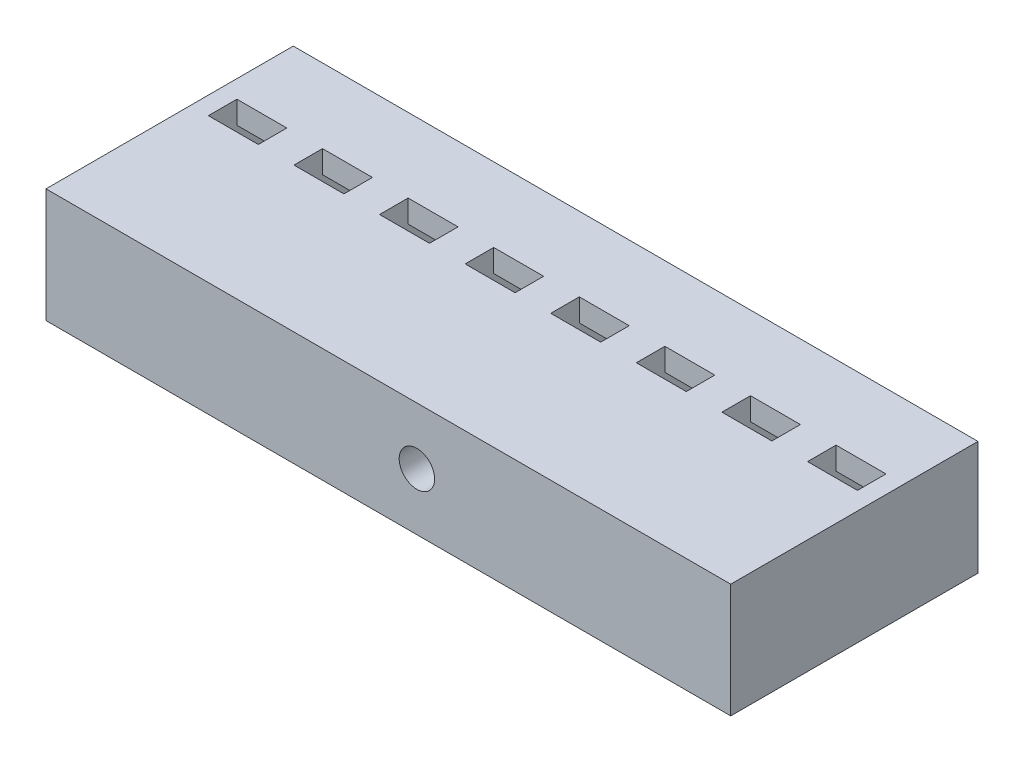
from build123d import *

# Parameters (mm, degrees)
SKETCH1_W           = 72
SKETCH1_H           = 22
BOSS_EXTRUDE1_DEPTH = 12
SKETCH2_W           = 5.25
SKETCH2_H           = 3
CUT_EXTRUDE1_DEPTH  = 77.23647421
LPATTERN2_COUNT     = 8
LPATTERN2_PITCH     = 9
SKETCH3_W           = 5.25
SKETCH3_H           = 7.25
CUT_EXTRUDE2_DEPTH  = 77.23647421
LPATTERN3_COUNT     = 8
LPATTERN3_PITCH     = 9
SKETCH4_W           = 72
SKETCH4_H           = 12
BOSS_EXTRUDE2_DEPTH = 4
SKETCH11_W          = 72
SKETCH11_H          = 12
BOSS_EXTRUDE3_DEPTH = 4
SKETCH12_R          = 1.865
CUT_EXTRUDE9_DEPTH  = 6


with BuildPart() as part:
    # Sketch1 → Boss-Extrude1 (new body)
    with BuildSketch(Plane(origin=(0, 0, 0), x_dir=(1, 0, 0), z_dir=(0, 1, 0))):
        with Locations((-36, 11)):
            Rectangle(SKETCH1_W, SKETCH1_H)
    extrude(amount=BOSS_EXTRUDE1_DEPTH)

    # Sketch2 → Cut-Extrude1 (cut, through all)
    with BuildSketch(Plane(origin=(0, 12, 0), x_dir=(1, 0, 0), z_dir=(0, 1, 0))):
        with Locations((-67.5, 12.7)):
            Rectangle(SKETCH2_W, SKETCH2_H)
    cut_extrude1 = extrude(amount=-CUT_EXTRUDE1_DEPTH, mode=Mode.SUBTRACT)

    # LPattern2: Cut-Extrude1 ×8
    with Locations(*[(i * LPATTERN2_PITCH, 0, 0) for i in range(1, LPATTERN2_COUNT)]):
        add(cut_extrude1, mode=Mode.SUBTRACT)

    # Sketch3 → Cut-Extrude2 (cut, through all)
    with BuildSketch(Plane(origin=(0, 0, -22), x_dir=(-1, 0, 0), z_dir=(0, 0, -1))):
        with Locations((67.5, 6)):
            Rectangle(SKETCH3_W, SKETCH3_H)
    cut_extrude2 = extrude(amount=-CUT_EXTRUDE2_DEPTH, mode=Mode.SUBTRACT)

    # LPattern3: Cut-Extrude2 ×8
    with Locations(*[(i * LPATTERN3_PITCH, 0, 0) for i in range(1, LPATTERN3_COUNT)]):
        add(cut_extrude2, mode=Mode.SUBTRACT)

    # Sketch4 → Boss-Extrude2 (add)
    with BuildSketch(Plane.XY):
        with Locations((-36, 6)):
            Rectangle(SKETCH4_W, SKETCH4_H)
    extrude(amount=-BOSS_EXTRUDE2_DEPTH)

    # Sketch11 → Boss-Extrude3 (add)
    with BuildSketch(Plane.XY):
        with Locations((-36, 6)):
            Rectangle(SKETCH11_W, SKETCH11_H)
    extrude(amount=BOSS_EXTRUDE3_DEPTH)

    # Sketch12 → Cut-Extrude9 (cut)
    with BuildSketch(Plane.XY.offset(4)):
        with Locations((-33, 6)):
            Circle(SKETCH12_R)
    extrude(amount=-CUT_EXTRUDE9_DEPTH, mode=Mode.SUBTRACT)


solid = part.part
